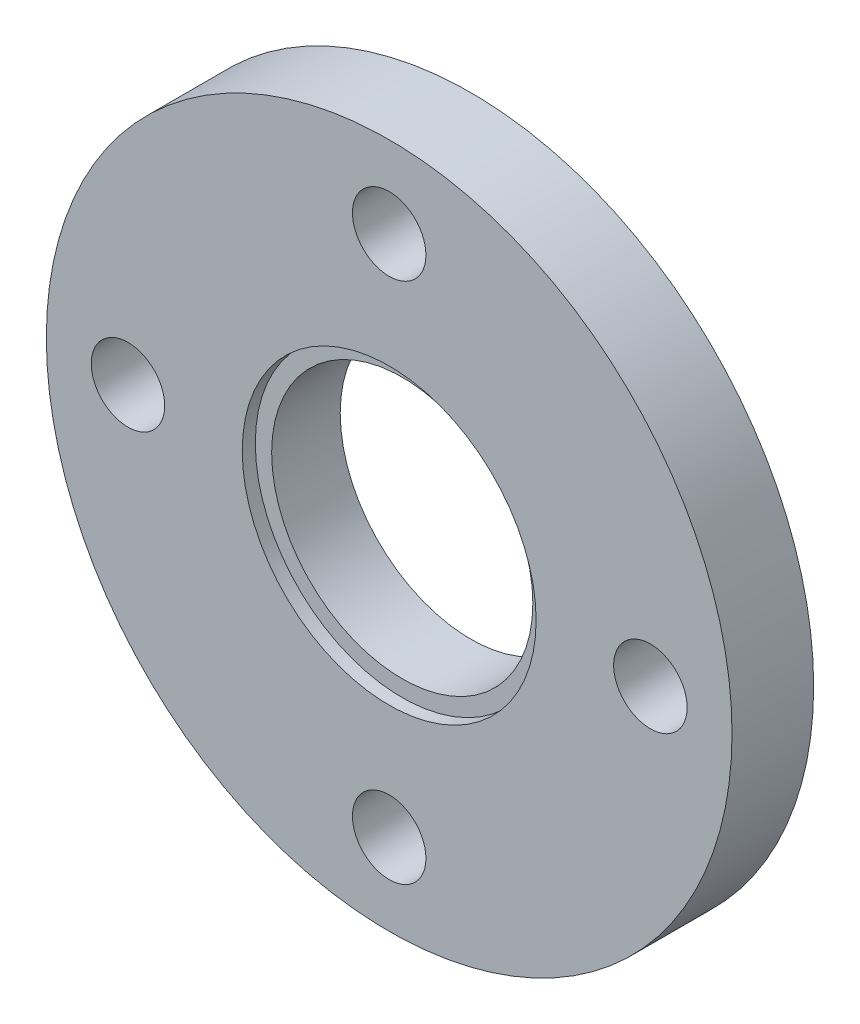
from build123d import *

# Parameters (mm, degrees)
SKETCH_1_R          = 21
SKETCH_1_R_2        = 8
EXTRUDE_1_DEPTH     = 5
HOLE_WIZARD_M41_D   = 4.5
SKETCH_4_R          = 9
CUT_EXTRUDE_1_DEPTH = 0.8


with BuildPart() as part:
    # Эскиз1 → Бобышка-Вытянуть1 (new body)
    with BuildSketch(Plane.XY):
        Circle(SKETCH_1_R)
        Circle(SKETCH_1_R_2, mode=Mode.SUBTRACT)
    extrude(amount=EXTRUDE_1_DEPTH)

    # Отверстие с зазором M41 (through all)
    with Locations(Plane.XY.offset(5)):
        with Locations((0, 16), (-16, 0), (0, -16), (16, 0)):
            Hole(HOLE_WIZARD_M41_D / 2)

    # Эскиз4 → Вырез-Вытянуть1 (cut)
    with BuildSketch(Plane.XY.offset(5)):
        Circle(SKETCH_4_R)
    extrude(amount=-CUT_EXTRUDE_1_DEPTH, mode=Mode.SUBTRACT)


solid = part.part
